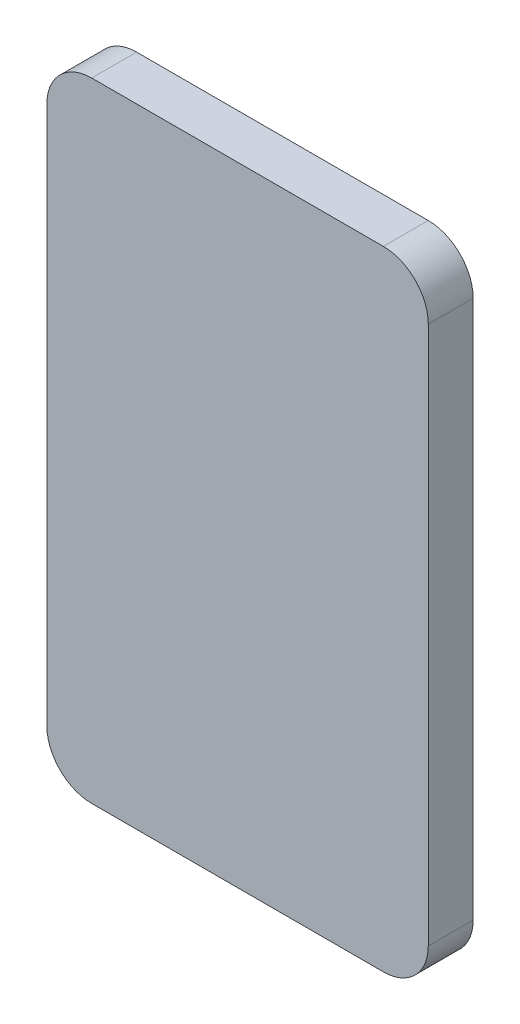
from build123d import *

# Parameters (mm, degrees)
SKETCH1_W           = 17
SKETCH1_H           = 28
BOSS_EXTRUDE1_DEPTH = 2
FILLET1_R           = 2


with BuildPart() as part:
    # Sketch1 → Boss-Extrude1 (new body)
    with BuildSketch(Plane.XY):
        with Locations((8.5, 14)):
            Rectangle(SKETCH1_W, SKETCH1_H)
    extrude(amount=BOSS_EXTRUDE1_DEPTH)

    # Fillet1
    fillet1_edges = [part.edges().sort_by_distance(p)[0] for p in [
        (0, 28, 1),
        (17, 28, 1),
        (17, 0, 1),
        (0, 0, 1),
    ]]
    fillet(fillet1_edges, radius=FILLET1_R)


solid = part.part
